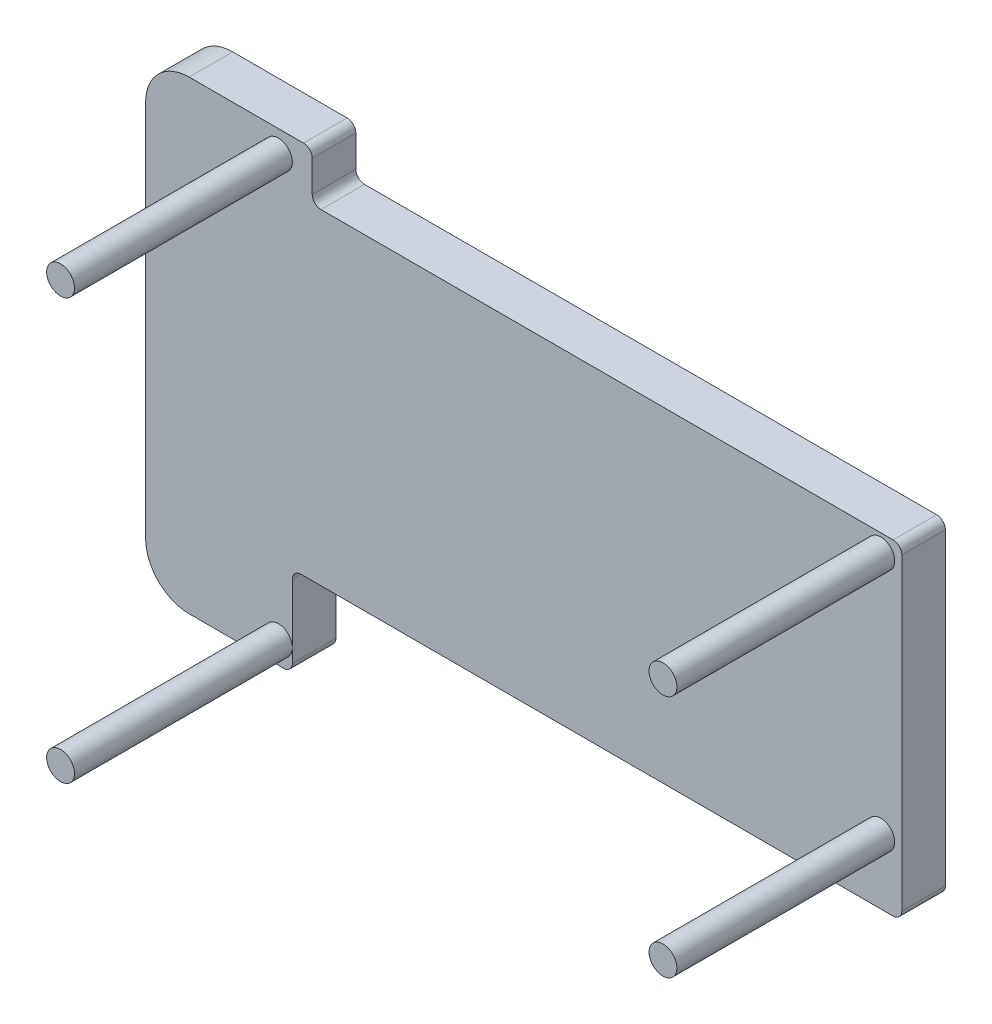
from build123d import *

# Parameters (mm, degrees)
SKETCH1_R             = 1.6
BOSS_EXTRUDE2_DEPTH   = 25
BOSS_EXTRUDE2_2_DEPTH = 25
BOSS_EXTRUDE2_3_DEPTH = 25
BOSS_EXTRUDE2_4_DEPTH = 25
BOSS_EXTRUDE4_DEPTH   = 5


with BuildPart() as part:
    # Sketch1 → Boss-Extrude2 (new body)
    with BuildSketch(Plane.XY):
        with Locations((-28.14771299, -24.13)):
            Circle(SKETCH1_R)
    extrude(amount=BOSS_EXTRUDE2_DEPTH)



with BuildPart() as body_2:
    # Sketch1 → Boss-Extrude2 2 (new body)
    with BuildSketch(Plane.XY):
        with Locations((40.977777778, -8.89)):
            Circle(SKETCH1_R)
    extrude(amount=BOSS_EXTRUDE2_2_DEPTH)


with BuildPart() as body_3:
    # Sketch1 → Boss-Extrude2 3 (new body)
    with BuildSketch(Plane.XY):
        with Locations((40.977777778, 19.05)):
            Circle(SKETCH1_R)
    extrude(amount=BOSS_EXTRUDE2_3_DEPTH)


with BuildPart() as body_4:
    # Sketch1 → Boss-Extrude2 4 (new body)
    with BuildSketch(Plane.XY):
        with Locations((-28.14771299, 24.13)):
            Circle(SKETCH1_R)
    extrude(amount=BOSS_EXTRUDE2_4_DEPTH)


with BuildPart() as part_1:
    add(part.part)

    add(body_2.part)  # Boss-Extrude4 merges body 2

    add(body_3.part)  # Boss-Extrude4 merges body 3

    add(body_4.part)  # Boss-Extrude4 merges body 4
    # Sketch1<6> → Boss-Extrude4 (add)
    with BuildSketch(Plane.XY):
        with BuildLine():
            Line((-24.266666667, 25.67), (-24.266666667, 22.066666667))
            ThreePointArc((-24.266666667, 22.066666667), (-23.973773448, 21.359559885), (-23.266666667, 21.066666667))
            Line((-23.266666667, 21.066666667), (42.38771299, 21.066666667))
            ThreePointArc((42.38771299, 21.066666667), (43.094819771, 20.773773448), (43.38771299, 20.066666667))
            Line((43.38771299, 20.066666667), (43.38771299, -15.318617799))
            ThreePointArc((43.38771299, -15.318617799), (43.094819771, -16.02572458), (42.38771299, -16.318617799))
            Line((42.38771299, -16.318617799), (-25.54771299, -16.318617799))
            ThreePointArc((-25.54771299, -16.318617799), (-26.254819771, -16.611511017), (-26.54771299, -17.318617799))
            Line((-26.54771299, -17.318617799), (-26.54771299, -24.13))
            Line((-26.54771299, -24.13), (-26.54771299, -25.67))
            ThreePointArc((-26.54771299, -25.67), (-26.840606209, -26.377106781), (-27.54771299, -26.67))
            Line((-27.54771299, -26.67), (-38.38771299, -26.67))
            ThreePointArc((-38.38771299, -26.67), (-41.923246896, -25.205533906), (-43.38771299, -21.67))
            Line((-43.38771299, -21.67), (-43.38771299, 21.67))
            ThreePointArc((-43.38771299, 21.67), (-41.923246896, 25.205533906), (-38.38771299, 26.67))
            Line((-38.38771299, 26.67), (-25.266666667, 26.67))
            ThreePointArc((-25.266666667, 26.67), (-24.559559885, 26.377106781), (-24.266666667, 25.67))
        make_face()
    extrude(amount=-BOSS_EXTRUDE4_DEPTH)


solid = part_1.part
